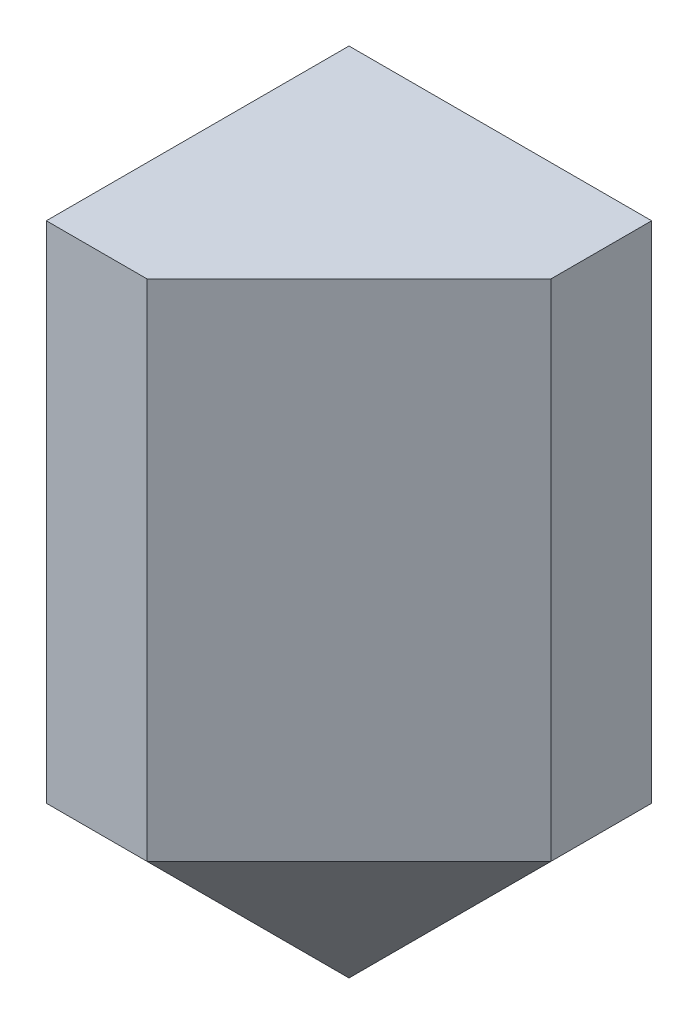
from build123d import *

# Parameters (mm, degrees)
SCHIZZO1_W                   = 30
SCHIZZO1_H                   = 40
ESTRUSIONE_ESTRUSIONE1_DEPTH = 30
SMUSSO1_SIZE                 = 20
ESTRUSIONE_ESTRUSIONE2_DEPTH = 30
FORO_PER_VITE_M5_1_D         = 5.5
FORO_PER_VITE_M5_1_DEPTH     = 13
FORO_PER_VITE_M5_1_TIP       = 1.652366702
FORO_PER_VITE_M5_2_D         = 5.5
FORO_PER_VITE_M5_2_DEPTH     = 13
FORO_PER_VITE_M5_2_TIP       = 1.652366702
SCHIZZO6_R                   = 7.5
TAGLIO_ESTRUSIONE1_DEPTH     = 3
FORO_PER_VITE_M4_1_D         = 4.4
FORO_PER_VITE_M4_1_DEPTH     = 10
FORO_PER_VITE_M4_1_TIP       = 1.321893362


with BuildPart() as part:
    # Schizzo1 → Estrusione-Estrusione1 (new body)
    with BuildSketch(Plane.XY):
        with Locations((15, 20)):
            Rectangle(SCHIZZO1_W, SCHIZZO1_H)
    extrude(amount=ESTRUSIONE_ESTRUSIONE1_DEPTH)

    # Smusso1
    smusso1_edges = [part.edges().sort_by_distance(p)[0] for p in [
        (30, 20, 30),
        (30, 0, 15),
        (15, 0, 30),
    ]]
    chamfer(smusso1_edges, length=SMUSSO1_SIZE)

    # Schizzo2 → Estrusione-Estrusione2 (add)
    with BuildSketch(Plane(origin=(0, 40, 0), x_dir=(1, 0, 0), z_dir=(0, 1, 0))):
        Polygon((0, 0), (30, 0), (30, -10), (10, -30), (0, -30), align=None)
    extrude(amount=ESTRUSIONE_ESTRUSIONE2_DEPTH)

    # Foro per Vite M5-1
    with Locations(Plane.ZY):
        with Locations((18, 20)):
            Hole(FORO_PER_VITE_M5_1_D / 2, depth=FORO_PER_VITE_M5_1_DEPTH)
            with Locations((0, 0, -(FORO_PER_VITE_M5_1_DEPTH + FORO_PER_VITE_M5_1_TIP / 2))):  # 118° drill point
                Cone(0, FORO_PER_VITE_M5_1_D / 2, FORO_PER_VITE_M5_1_TIP, mode=Mode.SUBTRACT)

    # Foro per Vite M5-2
    with Locations(Plane(origin=(18, 20, 0), x_dir=(-1, 0, 0), z_dir=(0, 0, -1))):
        with Locations((0, 0), (4, 28)):
            Hole(FORO_PER_VITE_M5_2_D / 2, depth=FORO_PER_VITE_M5_2_DEPTH)
            with Locations((0, 0, -(FORO_PER_VITE_M5_2_DEPTH + FORO_PER_VITE_M5_2_TIP / 2))):  # 118° drill point
                Cone(0, FORO_PER_VITE_M5_2_D / 2, FORO_PER_VITE_M5_2_TIP, mode=Mode.SUBTRACT)

    # Schizzo6 → Taglio-Estrusione1 (cut)
    with BuildSketch(Plane.ZY):
        with Locations((15, 55)):
            Circle(SCHIZZO6_R)
    extrude(amount=-TAGLIO_ESTRUSIONE1_DEPTH, mode=Mode.SUBTRACT)

    # Foro per Vite M4-1
    with Locations(Plane.ZY.offset(-3)):
        with Locations((15, 55)):
            Hole(FORO_PER_VITE_M4_1_D / 2, depth=FORO_PER_VITE_M4_1_DEPTH)
            with Locations((0, 0, -(FORO_PER_VITE_M4_1_DEPTH + FORO_PER_VITE_M4_1_TIP / 2))):  # 118° drill point
                Cone(0, FORO_PER_VITE_M4_1_D / 2, FORO_PER_VITE_M4_1_TIP, mode=Mode.SUBTRACT)


solid = part.part
